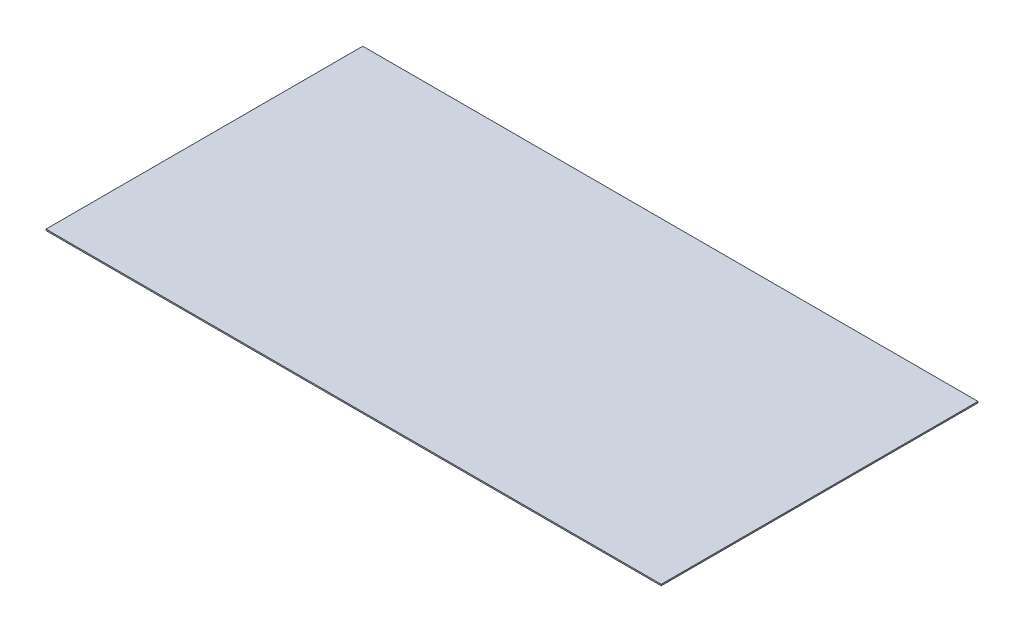
from build123d import *

# Parameters (mm, degrees)
SKETCH3_W           = 152.4
SKETCH3_H           = 0.635
BOSS_EXTRUDE1_DEPTH = 296


with BuildPart() as part:
    # Sketch3 → Boss-Extrude1 (new body)
    with BuildSketch(Plane(origin=(0, 0, 0), x_dir=(0, 0, -1), z_dir=(1, 0, 0))):
        with Locations((76.2, 0.3175)):
            Rectangle(SKETCH3_W, SKETCH3_H)
    extrude(amount=BOSS_EXTRUDE1_DEPTH)


solid = part.part
